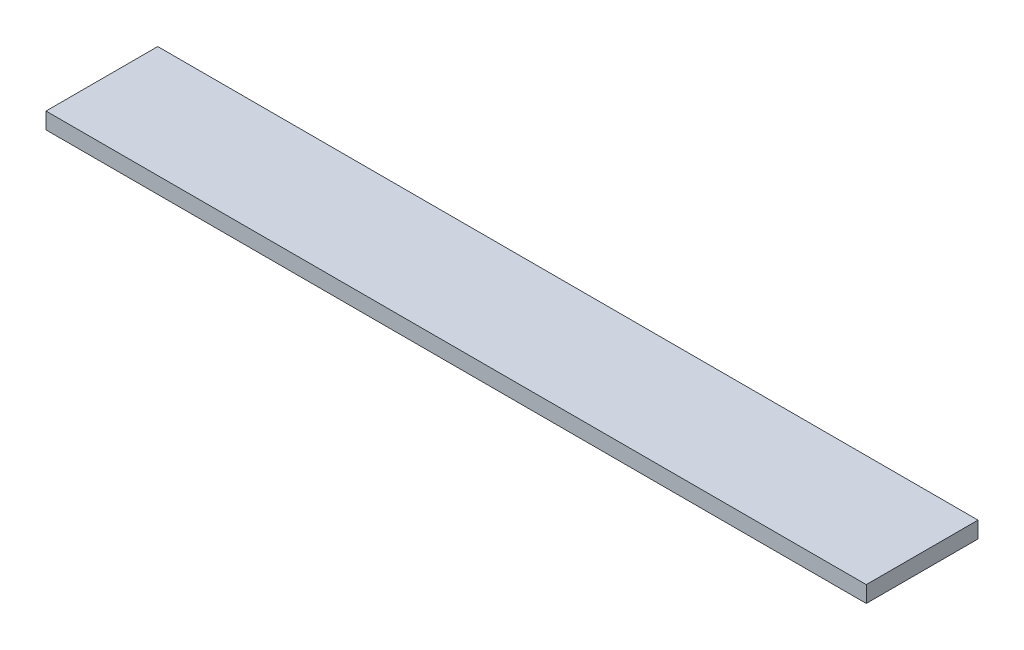
from build123d import *

# Parameters (mm, degrees)
SKETCH1_W           = 60.2
SKETCH1_H           = 8.2
BOSS_EXTRUDE1_DEPTH = 1.2
SKETCH2_R           = 1.5
CUT_EXTRUDE1_DEPTH  = 0.5


with BuildPart() as part:
    # Sketch1 → Boss-Extrude1 (new body)
    with BuildSketch(Plane(origin=(0, 0, 0), x_dir=(1, 0, 0), z_dir=(0, 1, 0))):
        with Locations((30.1, -4.1)):
            Rectangle(SKETCH1_W, SKETCH1_H)
    extrude(amount=BOSS_EXTRUDE1_DEPTH)

    # Sketch2 → Cut-Extrude1 (cut)
    with BuildSketch(Plane(origin=(0, 0, 0), x_dir=(-1, 0, 0), z_dir=(0, -1, 0))):
        with Locations(Location((-7.52, -1.88, 0), (0, 0, 90))):
            Circle(SKETCH2_R)
        with Locations(Location((-57.8, -1.88, 0), (0, 0, 90))):
            Circle(SKETCH2_R)
        with Locations(Location((-57.8, -6.12, 0), (0, 0, 90))):
            Circle(SKETCH2_R)
    extrude(amount=-CUT_EXTRUDE1_DEPTH, mode=Mode.SUBTRACT)


solid = part.part
